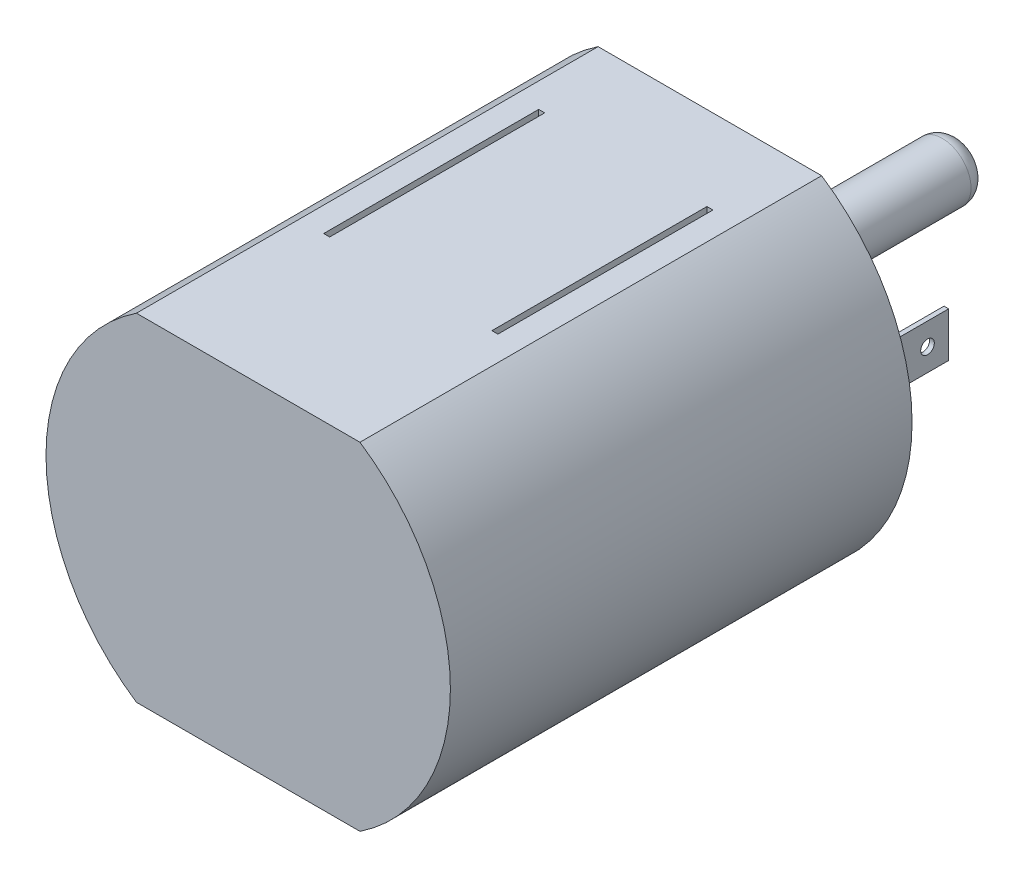
from build123d import *

# Parameters (mm, degrees)
BOSS_EXTRUDE1_DEPTH = 13.7
SKETCH3_W           = 0.178571672
SKETCH3_H           = 6.380917094
CUT_EXTRUDE1_DEPTH  = 0.2
SKETCH4_R           = 0.85
BOSS_EXTRUDE3_DEPTH = 7.4
SKETCH5_W           = 0.138137893
SKETCH5_H           = 1.329179466
BOSS_EXTRUDE4_DEPTH = 2.8
SKETCH6_R           = 0.20198457
CUT_EXTRUDE2_DEPTH  = 9.6
REDONDEO1_R         = 0.5


with BuildPart() as part:
    # Sketch1 → Boss-Extrude1 (new body)
    with BuildSketch(Plane.XY):
        with BuildLine():
            Line((-3.31662479, -5), (3.31662479, -5))
            ThreePointArc((3.31662479, -5), (6, 0), (3.31662479, 5))
            Line((3.31662479, 5), (-3.31662479, 5))
            ThreePointArc((-3.31662479, 5), (-6, 0), (-3.31662479, -5))
        make_face()
    extrude(amount=BOSS_EXTRUDE1_DEPTH)

    # Sketch3 → Cut-Extrude1 (cut)
    with BuildSketch(Plane(origin=(0, 5, 0), x_dir=(1, 0, 0), z_dir=(0, 1, 0))):
        with Locations((-2.495957535, -5.684471075)):
            Rectangle(SKETCH3_W, SKETCH3_H)
        with Locations((2.495957535, -5.684471075)):
            Rectangle(SKETCH3_W, SKETCH3_H)
    extrude(amount=-CUT_EXTRUDE1_DEPTH, mode=Mode.SUBTRACT)

    # Sketch4 → Boss-Extrude3 (add)
    with BuildSketch(Plane(origin=(0, 0, 0), x_dir=(-1, 0, 0), z_dir=(0, 0, -1))):
        with Locations(Location((0, 0, 0), (0, 0, 180))):
            Circle(SKETCH4_R)
    extrude(amount=BOSS_EXTRUDE3_DEPTH)

    # Sketch5 → Boss-Extrude4 (add)
    with BuildSketch(Plane(origin=(0, 0, 0), x_dir=(-1, 0, 0), z_dir=(0, 0, -1))):
        with Locations((-4.217525365, 0)):
            Rectangle(SKETCH5_W, SKETCH5_H)
        with Locations((4.217525365, 0)):
            Rectangle(SKETCH5_W, SKETCH5_H)
    extrude(amount=BOSS_EXTRUDE4_DEPTH)

    # Sketch6 → Cut-Extrude2 (cut)
    with BuildSketch(Plane.ZY.offset(4.286594311)):
        with Locations((-2.171650698, 0)):
            Circle(SKETCH6_R)
    extrude(amount=-CUT_EXTRUDE2_DEPTH, mode=Mode.SUBTRACT)

    # Redondeo1
    redondeo1_edges = [part.edges().sort_by_distance(p)[0] for p in [
        (-0.85, 0, -7.4),
    ]]
    fillet(redondeo1_edges, radius=REDONDEO1_R)


solid = part.part
